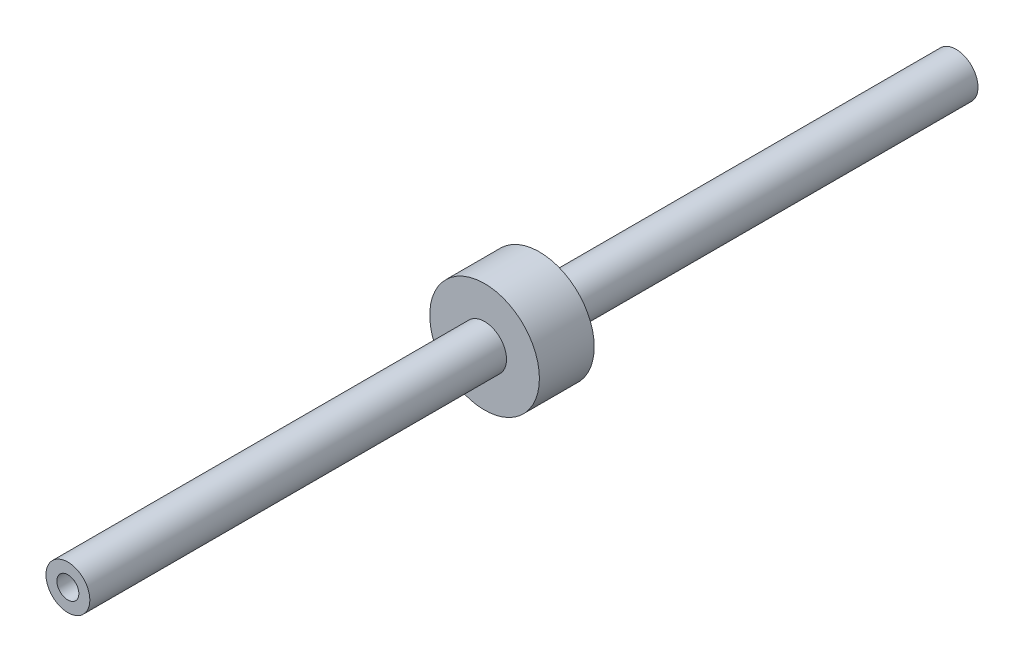
from build123d import *

# Parameters (mm, degrees)
SKETCH1_R               = 2
BOSS_EXTRUDE1_DEPTH     = 38
SKETCH2_R               = 5
BOSS_EXTRUDE2_DEPTH     = 5
SKETCH3_R               = 2
BOSS_EXTRUDE3_DEPTH     = 38
SKETCH4_R               = 1
CUT_EXTRUDE1_DEPTH      = 5
CUT_EXTRUDE2_DEPTH      = 82.308056181
CUT_EXTRUDE2_DEPTH_BACK = 5
SKETCH5_R               = 1


with BuildPart() as part:
    # Sketch1 → Boss-Extrude1 (new body)
    with BuildSketch(Plane.XY):
        Circle(SKETCH1_R)
    extrude(amount=BOSS_EXTRUDE1_DEPTH)

    # Sketch2 → Boss-Extrude2 (add)
    with BuildSketch(Plane.XY.offset(38)):
        Circle(SKETCH2_R)
    extrude(amount=BOSS_EXTRUDE2_DEPTH)

    # Sketch3 → Boss-Extrude3 (add)
    with BuildSketch(Plane.XY.offset(43)):
        Circle(SKETCH3_R)
    extrude(amount=BOSS_EXTRUDE3_DEPTH)

    # Sketch4 → Cut-Extrude1 (cut)
    with BuildSketch(Plane(origin=(0, 0, 0), x_dir=(-1, 0, 0), z_dir=(0, 0, -1))):
        Circle(SKETCH4_R)
    extrude(amount=-CUT_EXTRUDE1_DEPTH, mode=Mode.SUBTRACT)

    # Sketch5 → Cut-Extrude2 (cut, two sides: drawn at the far end of the back side and taken through both)
    with BuildSketch(Plane.XY.offset(81).offset(-CUT_EXTRUDE2_DEPTH_BACK)):
        with Locations(Location((0, 0, 0), (0, 0, 180))):
            Circle(SKETCH5_R)
    extrude(amount=CUT_EXTRUDE2_DEPTH + CUT_EXTRUDE2_DEPTH_BACK, mode=Mode.SUBTRACT)


solid = part.part
